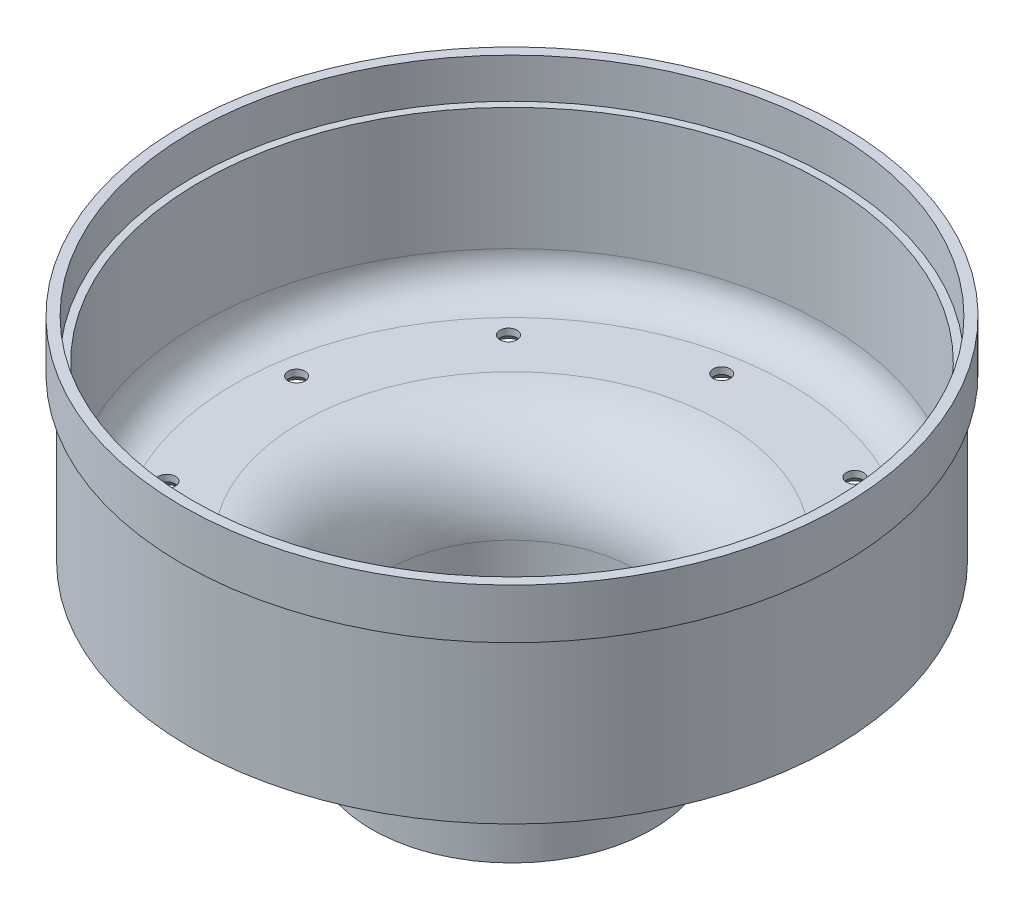
from build123d import *

# Parameters (mm, degrees)
M3_SFHCS_IN_HAV_A1_D           = 3.4
M3_SFHCS_IN_HAV_A1_CSINK_D     = 6.72
M3_SFHCS_IN_HAV_A1_CSINK_ANGLE = 90
DAIRESEL_KAPLAMA1_COUNT        = 10


with BuildPart() as part:
    # Çizim1 → Döndür2 (revolve)
    with BuildSketch(Plane.XY, mode=Mode.PRIVATE) as d_nd_r2_sk:
        with BuildLine():
            Line((26.6, -13.648391358), (26.6, -3.648391358))
            Line((26.6, -3.648391358), (25.1, -3.648391358))
            Line((25.1, -3.648391358), (25.1, 4.751608642))
            ThreePointArc((25.1, 4.751608642), (30.108474042, 16.843134601), (42.2, 21.851608642))
            Line((42.2, 21.851608642), (55.5, 21.851608642))
            ThreePointArc((55.5, 21.851608642), (60.449747468, 23.901861174), (62.5, 28.851608642))
            Line((62.5, 28.851608642), (62.5, 53.351608642))
            Line((62.5, 53.351608642), (64, 53.351608642))
            Line((64, 53.351608642), (64, 61.351608642))
            Line((64, 61.351608642), (66, 61.351608642))
            Line((66, 61.351608642), (66, 51.351608642))
            Line((66, 51.351608642), (64.5, 51.351608642))
            Line((64.5, 51.351608642), (64.5, 18.851608642))
            Line((64.5, 18.851608642), (39.98, 18.851608642))
            ThreePointArc((39.98, 18.851608642), (31.57957144, 15.372037203), (28.1, 6.971608642))
            Line((28.1, 6.971608642), (28.1, -13.648391358))
            Line((28.1, -13.648391358), (26.6, -13.648391358))
        make_face()
    revolve(d_nd_r2_sk.sketch.rotate(Axis((0, 0, 0), (0, 1, 0)), 90), axis=Axis((0, 0, 0), (0, 1, 0)))

    # M3 SFHCS İçin Havşa1 (through all)
    with Locations(Plane(origin=(8.5, 18.851608642, 50.5), x_dir=(0, 0, -1), z_dir=(0, -1, 0))):
        with Locations((0, 0)):
            m3_sfhcs_in_hav_a1 = CounterSinkHole(M3_SFHCS_IN_HAV_A1_D / 2, M3_SFHCS_IN_HAV_A1_CSINK_D / 2, counter_sink_angle=M3_SFHCS_IN_HAV_A1_CSINK_ANGLE)

    # Dairesel Kaplama1: M3 SFHCS İçin Havşa1 ×10 about axis
    dairesel_kaplama1_axis = Axis((0, 0, 0), (0, 1, 0))
    for i in range(1, DAIRESEL_KAPLAMA1_COUNT):
        add(m3_sfhcs_in_hav_a1.rotate(dairesel_kaplama1_axis, i * 360 / DAIRESEL_KAPLAMA1_COUNT), mode=Mode.SUBTRACT)


solid = part.part
